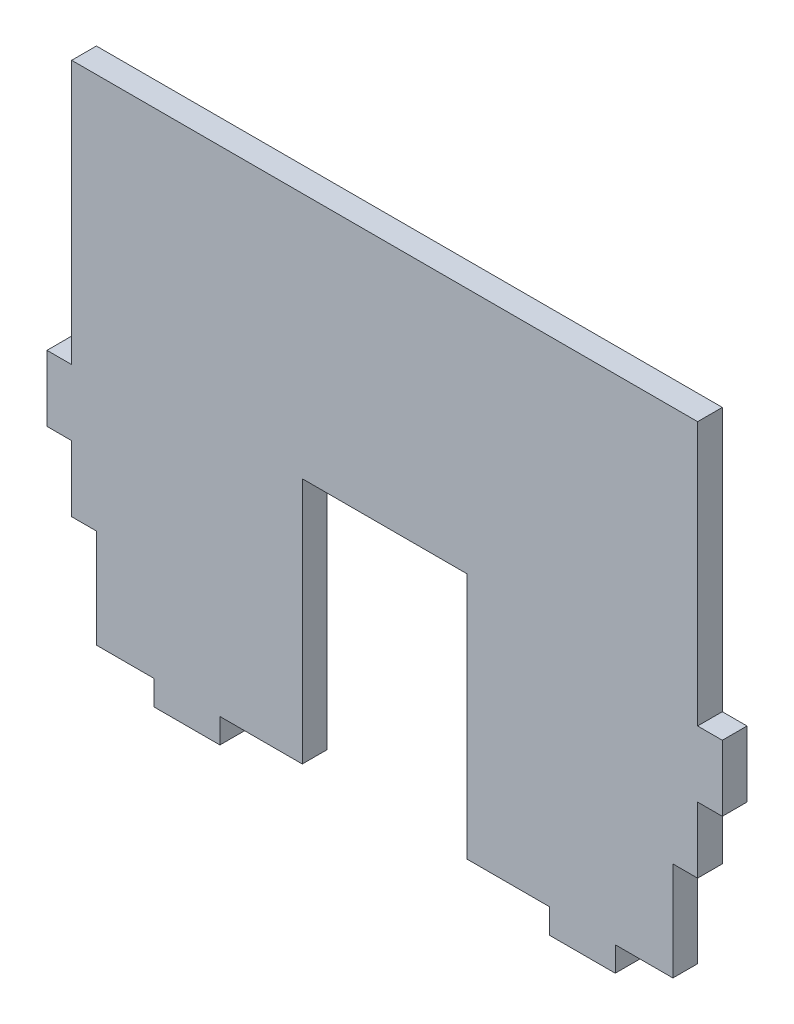
from build123d import *

# Parameters (mm, degrees)
EXTRUDE_1_DEPTH = 3


with BuildPart() as part:
    # 草图1 → 凸台-拉伸1 (new body)
    with BuildSketch(Plane.XY):
        Polygon((10, 0), (10, -3), (18, -3), (18, 0), (28, 0), (28, 4.94295662), (28, 30), (48, 30), (48, 4.94295662), (48, 0), (58, 0), (58, -3), (66, -3), (66, 0), (73, 0), (73, 12), (76, 12), (76, 20), (79, 20), (79, 28), (76, 28), (76, 60), (0, 60), (0, 28), (-3, 28), (-3, 20), (0, 20), (0, 12), (3, 12), (3, 0), align=None)
    extrude(amount=EXTRUDE_1_DEPTH)


solid = part.part
